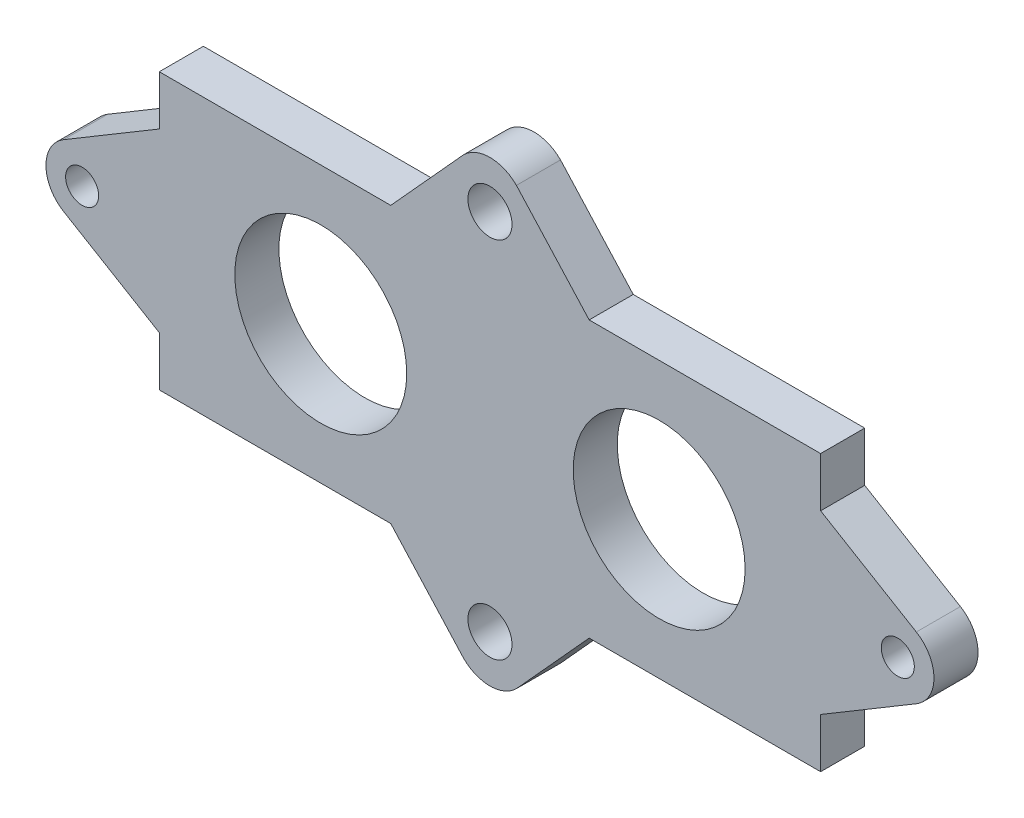
from build123d import *

# Parameters (mm, degrees)
SKETCH1_R           = 7.8
SKETCH1_R_2         = 2
SKETCH1_R_3         = 1.5
BOSS_EXTRUDE1_DEPTH = 4


with BuildPart() as part:
    # Sketch1 → Boss-Extrude1 (new body)
    with BuildSketch(Plane.XY):
        with BuildLine():
            Line((-9, 12.5), (-2.401010284, 19.772380391))
            ThreePointArc((-2.401010284, 19.772380391), (0, 20.766911414), (2.401010284, 19.772380391))
            Line((2.401010284, 19.772380391), (9, 12.5))
            Line((9, 12.5), (30, 12.5))
            Line((30, 12.5), (30, 8))
            Line((30, 8), (38.682501327, 2.820305125))
            ThreePointArc((38.682501327, 2.820305125), (40.284041978, 0), (38.682501327, -2.820305125))
            Line((38.682501327, -2.820305125), (30, -8))
            Line((30, -8), (30, -12.5))
            Line((30, -12.5), (9, -12.5))
            Line((9, -12.5), (2.401010284, -19.772380391))
            ThreePointArc((2.401010284, -19.772380391), (0, -20.766911414), (-2.401010284, -19.772380391))
            Line((-2.401010284, -19.772380391), (-9, -12.5))
            Line((-9, -12.5), (-30, -12.5))
            Line((-30, -12.5), (-30, -8))
            Line((-30, -8), (-38.682501327, -2.820305125))
            ThreePointArc((-38.682501327, -2.820305125), (-40.284041978, 0), (-38.682501327, 2.820305125))
            Line((-38.682501327, 2.820305125), (-30, 8))
            Line((-30, 8), (-30, 12.5))
            Line((-30, 12.5), (-9, 12.5))
        make_face()
        with Locations((-15.35, 0)):
            Circle(SKETCH1_R, mode=Mode.SUBTRACT)
        with Locations((15.35, 0)):
            Circle(SKETCH1_R, mode=Mode.SUBTRACT)
        with Locations((0, 16.5)):
            Circle(SKETCH1_R_2, mode=Mode.SUBTRACT)
        with Locations(Location((0, -16.5, 0), (0, 0, 180))):
            Circle(SKETCH1_R_2, mode=Mode.SUBTRACT)
        with Locations((-37, 0)):
            Circle(SKETCH1_R_3, mode=Mode.SUBTRACT)
        with Locations(Location((37, 0, 0), (0, 0, 180))):
            Circle(SKETCH1_R_3, mode=Mode.SUBTRACT)
    extrude(amount=BOSS_EXTRUDE1_DEPTH)


solid = part.part
